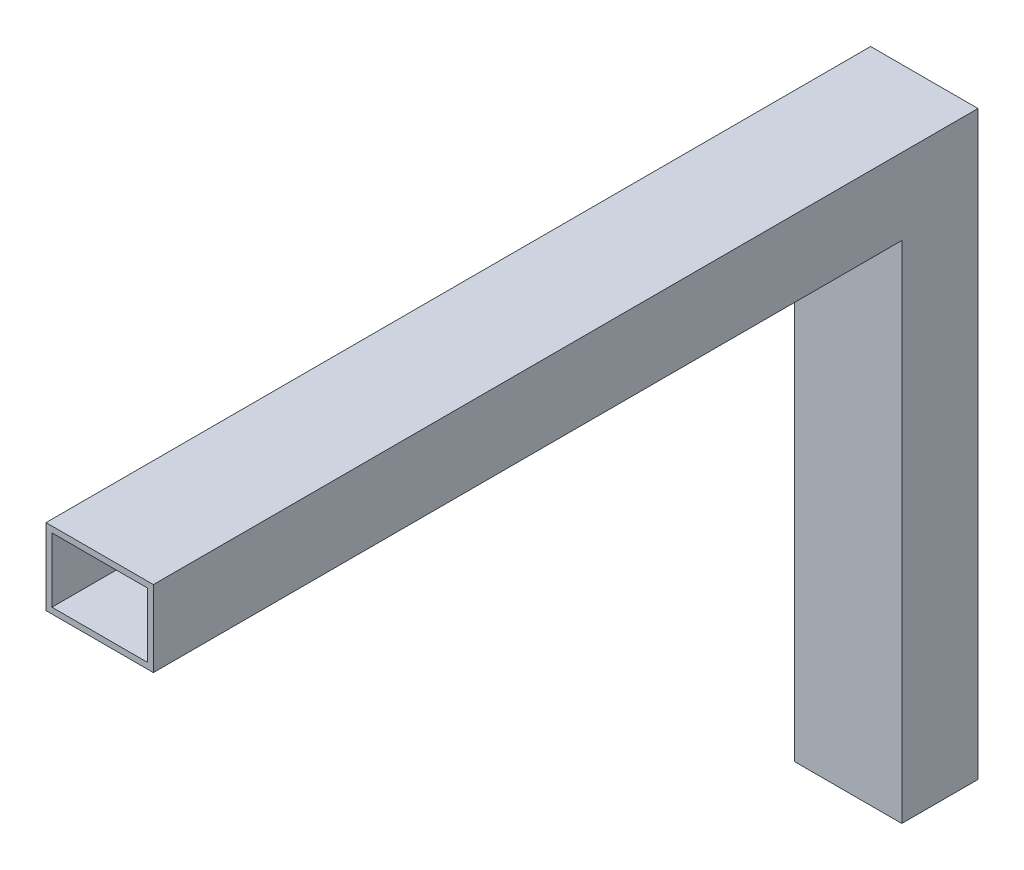
from build123d import *

# Parameters (mm, degrees)
SKETCH2_W   = 9.050402016
SKETCH2_H   = 6.425792272
SKETCH2_W_2 = 8.050402016
SKETCH2_H_2 = 5.425792272


with BuildPart() as part:
    # Sweep-Thin1: sweep along a path in Sketch1
    with BuildLine(Plane(origin=(0, 0, 0), x_dir=(0, 0, -1), z_dir=(1, 0, 0))) as sweep_thin1_path:
        Line((-59.908239877, 20.940148661), (6.379118135, 20.940148661))
        Line((6.379118135, 20.940148661), (6.379118135, -24.823090134))
    # Sketch2 → Sweep-Thin1 (sweep)
    with BuildSketch(Plane(origin=(0, 20.940148661, 59.908239877), x_dir=(-1, 0, 0), z_dir=(0, 0, -1))):
        Rectangle(SKETCH2_W, SKETCH2_H)
        Rectangle(SKETCH2_W_2, SKETCH2_H_2, mode=Mode.SUBTRACT)
    sweep(path=sweep_thin1_path.line, transition=Transition.RIGHT)


solid = part.part
